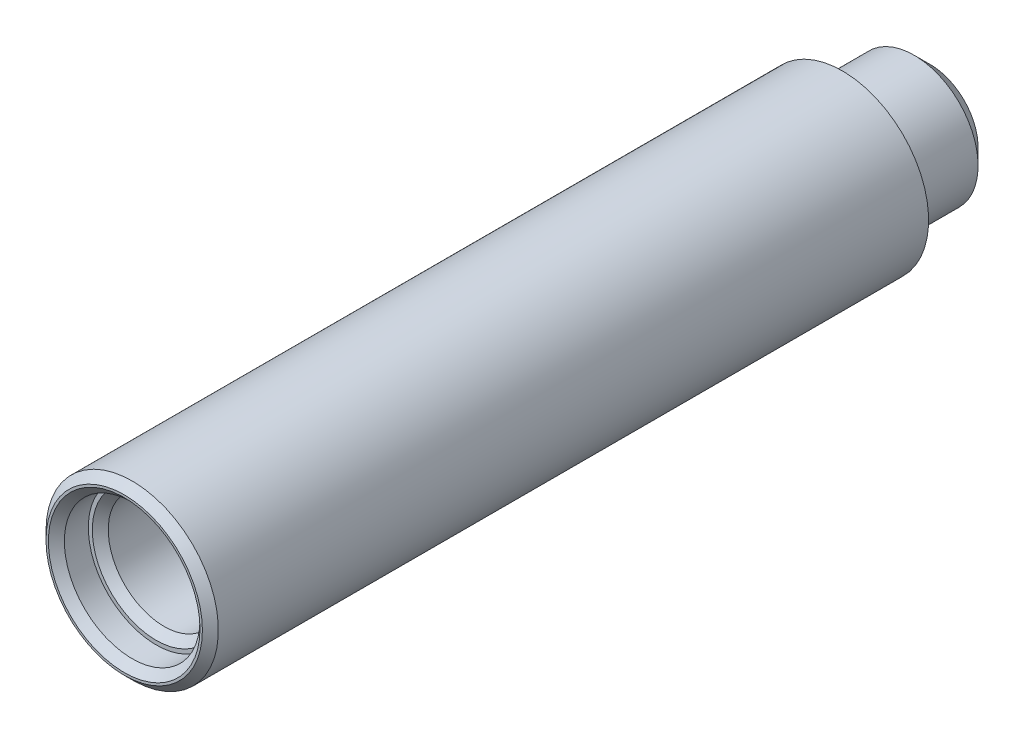
from build123d import *

# Parameters (mm, degrees)
SKETCH_1_R                = 5.4
EXTRUDE_1_DEPTH           = 45
EXTRUDE_3_DEPTH           = 5.4
M8X1_0_TAPPED_HOLE1_D     = 7
M8X1_0_TAPPED_HOLE1_DEPTH = 13
M8X1_0_TAPPED_HOLE1_TIP   = 2.103012167
M3_TAPPED_HOLE1_D         = 2.5
M3_TAPPED_HOLE1_DEPTH     = 7.5
M3_TAPPED_HOLE1_TIP       = 0.751075774
CHAMFER_1_SIZE            = 0.5
CHAMFER_2_SIZE            = 0.5
SKETCH_9_R                = 4.25
CUT_EXTRUDE_5_DEPTH       = 2
CHAMFER_3_SIZE            = 0.5
SKETCH_10_W               = 90.830281396
SKETCH_10_H               = 34.560289278
CUT_EXTRUDE_1_DEPTH       = 85
EXTRUDE_START             = 0.5
SKETCH_11_R               = 3.5
EXTRUDE_1_2_DEPTH         = 0.5
SKETCH_12_R               = 4
EXTRUDE_2_DEPTH           = 5
CHAMFER_4_SIZE            = 1


with BuildPart() as part:
    # 草图1 → Extrude 1 (new body)
    with BuildSketch(Plane.XY):
        with Locations(Location((0, 0, 0), (0, 0, 180))):
            Circle(SKETCH_1_R)
    extrude(amount=EXTRUDE_1_DEPTH)

    # 草图4 → 拉伸3 (add, symmetric)
    with BuildSketch(Plane.XZ):
        with BuildLine():
            Line((-22, 0), (22, 0))
            Line((22, 0), (28, -15.05119142))
            ThreePointArc((28, -15.05119142), (0, -12), (-28, -15.05119142))
            Line((-28, -15.05119142), (-22, 0))
        make_face()
    extrude(amount=EXTRUDE_3_DEPTH, both=True)

    # M8x1.0 Tapped Hole1
    with Locations(Plane.XY.offset(45)):
        with Locations((0, 0)):
            Hole(M8X1_0_TAPPED_HOLE1_D / 2, depth=M8X1_0_TAPPED_HOLE1_DEPTH)
            with Locations((0, 0, -(M8X1_0_TAPPED_HOLE1_DEPTH + M8X1_0_TAPPED_HOLE1_TIP / 2))):  # 118° drill point
                Cone(0, M8X1_0_TAPPED_HOLE1_D / 2, M8X1_0_TAPPED_HOLE1_TIP, mode=Mode.SUBTRACT)

    # M3 Tapped Hole1
    with Locations(Plane(origin=(-19.5, -1.4, 0), x_dir=(0, 1, 0), z_dir=(0, 0, 1))):
        with Locations((0, 0), (0, -39)):
            Hole(M3_TAPPED_HOLE1_D / 2, depth=M3_TAPPED_HOLE1_DEPTH)
            with Locations((0, 0, -(M3_TAPPED_HOLE1_DEPTH + M3_TAPPED_HOLE1_TIP / 2))):  # 118° drill point
                Cone(0, M3_TAPPED_HOLE1_D / 2, M3_TAPPED_HOLE1_TIP, mode=Mode.SUBTRACT)

    # 倒角1
    chamfer_1_edges = [part.edges().sort_by_distance(p)[0] for p in [
        (19.5, -0.15, 0),
        (-19.5, -0.15, 0),
    ]]
    chamfer(chamfer_1_edges, length=CHAMFER_1_SIZE)

    # 倒角2
    chamfer_2_edges = [part.edges().sort_by_distance(p)[0] for p in [
        (5.4, 0, 45),
    ]]
    chamfer(chamfer_2_edges, length=CHAMFER_2_SIZE)

    # 草图9 → 拉伸5 (cut)
    with BuildSketch(Plane.XY.offset(45)):
        Circle(SKETCH_9_R)
    extrude(amount=-CUT_EXTRUDE_5_DEPTH, mode=Mode.SUBTRACT)

    # 倒角3
    chamfer_3_edges = [part.edges().sort_by_distance(p)[0] for p in [
        (-4.25, 0, 45),
        (3.5, 0, 43),
    ]]
    chamfer(chamfer_3_edges, length=CHAMFER_3_SIZE)

    # 草图10 → 切除-拉伸1 (cut)
    with BuildSketch(Plane.XY):
        Rectangle(SKETCH_10_W, SKETCH_10_H)
    extrude(amount=-CUT_EXTRUDE_1_DEPTH, mode=Mode.SUBTRACT)

    # 草图11 → Extrude 1 2 (add)
    with BuildSketch(Plane(origin=(0, 0, 0), x_dir=(-1, 0, 0), z_dir=(0, 0, -1)).offset(EXTRUDE_START)):
        with Locations(Location((0, 0, 0), (0, 0, 180))):
            Circle(SKETCH_11_R)
    extrude(amount=-EXTRUDE_1_2_DEPTH)

    # 草图12 → 凸台-拉伸2 (add)
    with BuildSketch(Plane(origin=(0, 0, -0.5), x_dir=(-1, 0, 0), z_dir=(0, 0, -1))):
        Circle(SKETCH_12_R)
    extrude(amount=EXTRUDE_2_DEPTH)

    # 倒角4
    chamfer_4_edges = [part.edges().sort_by_distance(p)[0] for p in [
        (4, 0, -5.5),
    ]]
    chamfer(chamfer_4_edges, length=CHAMFER_4_SIZE)


solid = part.part
